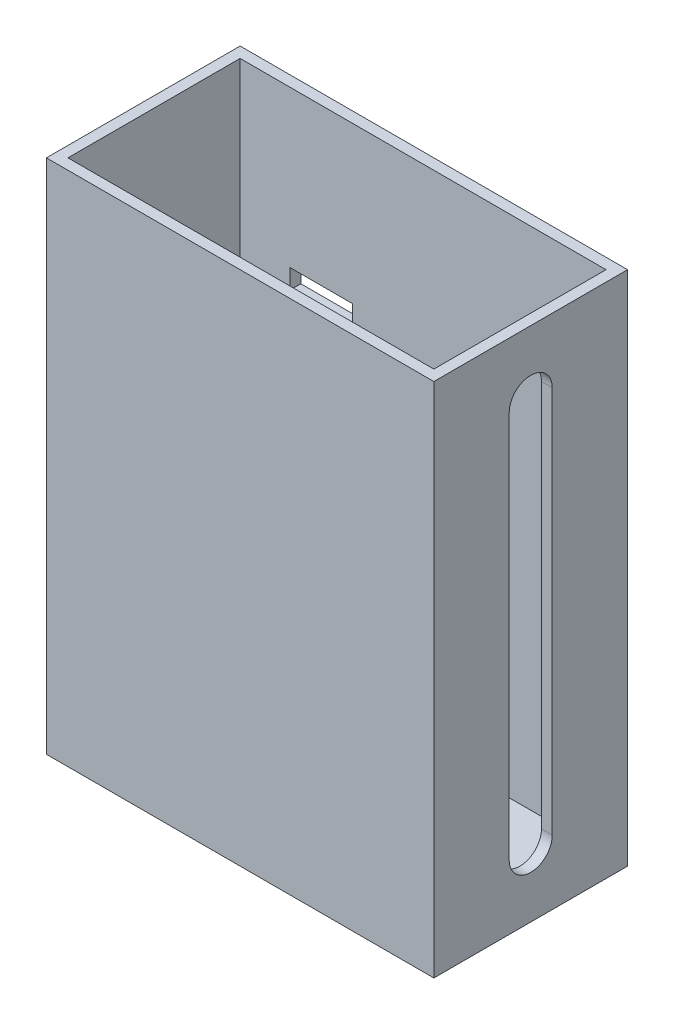
from build123d import *

# Parameters (mm, degrees)
SKETCH1_W           = 457.2
SKETCH1_H           = 228.6
BOSS_EXTRUDE1_DEPTH = 609.6
SHELL2_T            = -12.7
CUT_EXTRUDE2_REACH  = 772.525
CUT_EXTRUDE3_REACH  = 692.02
SKETCH4_W           = 31.75
SKETCH4_H           = 34.29
SKETCH4_W_2         = 36.83
SKETCH4_H_2         = 11.43
CUT_EXTRUDE17_DEPTH = 55.88


with BuildPart() as part:
    # Sketch1 → Boss-Extrude1 (new body)
    with BuildSketch(Plane(origin=(0, 0, 0), x_dir=(1, 0, 0), z_dir=(0, 1, 0))):
        Rectangle(SKETCH1_W, SKETCH1_H)
    extrude(amount=BOSS_EXTRUDE1_DEPTH)

    # Shell2
    shell2_openings = [part.faces().sort_by_distance(p)[0] for p in [
        (0, 609.6, 0),
    ]]
    offset(amount=SHELL2_T, openings=shell2_openings, kind=Kind.INTERSECTION)

    # Sketch3 → Cut-Extrude2 (cut, up to next)
    with BuildSketch(Plane(origin=(228.6, 0, 0), x_dir=(0, 0, -1), z_dir=(1, 0, 0)), mode=Mode.PRIVATE) as cut_extrude2_sk1:
        with BuildLine():
            Line((-25.4, 76.2), (-25.4, 533.4))
            ThreePointArc((-25.4, 533.4), (0, 558.8), (25.4, 533.4))
            Line((25.4, 533.4), (25.4, 76.2))
            ThreePointArc((25.4, 76.2), (0, 50.8), (-25.4, 76.2))
        make_face()
    cut_extrude2_tool1 = extrude(cut_extrude2_sk1.sketch, amount=-CUT_EXTRUDE2_REACH, mode=Mode.PRIVATE) & part.part
    add(cut_extrude2_tool1.solids().sort_by_distance((228.6, 304.8, 0))[0], mode=Mode.SUBTRACT)

    # Sketch4 → Cut-Extrude3 (cut, up to next)
    with BuildSketch(Plane(origin=(0, 0, -114.3), x_dir=(-1, 0, 0), z_dir=(0, 0, -1)), mode=Mode.PRIVATE) as cut_extrude3_sk1:
        with Locations((109.44862115, 351.970372474)):
            Rectangle(SKETCH4_W, SKETCH4_H)
    cut_extrude3_tool1 = extrude(cut_extrude3_sk1.sketch, amount=-CUT_EXTRUDE3_REACH, mode=Mode.PRIVATE) & part.part
    # Sketch4 → Cut-Extrude3 (cut, up to next)
    with BuildSketch(Plane(origin=(0, 0, -114.3), x_dir=(-1, 0, 0), z_dir=(0, 0, -1)), mode=Mode.PRIVATE) as cut_extrude3_sk2:
        with Locations((109.44862115, 317.680372474)):
            Rectangle(SKETCH4_W, SKETCH4_H)
    cut_extrude3_tool2 = extrude(cut_extrude3_sk2.sketch, amount=-CUT_EXTRUDE3_REACH, mode=Mode.PRIVATE) & part.part
    # Sketch4 → Cut-Extrude3 (cut, up to next)
    with BuildSketch(Plane(origin=(0, 0, -114.3), x_dir=(-1, 0, 0), z_dir=(0, 0, -1)), mode=Mode.PRIVATE) as cut_extrude3_sk3:
        with Locations((141.19862115, 317.680372474)):
            Rectangle(SKETCH4_W, SKETCH4_H)
    cut_extrude3_tool3 = extrude(cut_extrude3_sk3.sketch, amount=-CUT_EXTRUDE3_REACH, mode=Mode.PRIVATE) & part.part
    # Sketch4 → Cut-Extrude3 (cut, up to next)
    with BuildSketch(Plane(origin=(0, 0, -114.3), x_dir=(-1, 0, 0), z_dir=(0, 0, -1)), mode=Mode.PRIVATE) as cut_extrude3_sk4:
        with Locations((141.19862115, 351.970372474)):
            Rectangle(SKETCH4_W, SKETCH4_H)
    cut_extrude3_tool4 = extrude(cut_extrude3_sk4.sketch, amount=-CUT_EXTRUDE3_REACH, mode=Mode.PRIVATE) & part.part
    # Sketch4 → Cut-Extrude3 (cut, up to next)
    with BuildSketch(Plane(origin=(0, 0, -114.3), x_dir=(-1, 0, 0), z_dir=(0, 0, -1)), mode=Mode.PRIVATE) as cut_extrude3_sk5:
        with Locations((138.56658474, 419.56196337)):
            Rectangle(SKETCH4_W_2, SKETCH4_H_2)
    cut_extrude3_tool5 = extrude(cut_extrude3_sk5.sketch, amount=-CUT_EXTRUDE3_REACH, mode=Mode.PRIVATE) & part.part
    # Sketch4 → Cut-Extrude3 (cut, up to next)
    with BuildSketch(Plane(origin=(0, 0, -114.3), x_dir=(-1, 0, 0), z_dir=(0, 0, -1)), mode=Mode.PRIVATE) as cut_extrude3_sk6:
        with Locations((138.56658474, 408.13196337)):
            Rectangle(SKETCH4_W_2, SKETCH4_H_2)
    cut_extrude3_tool6 = extrude(cut_extrude3_sk6.sketch, amount=-CUT_EXTRUDE3_REACH, mode=Mode.PRIVATE) & part.part
    # Sketch4 → Cut-Extrude3 (cut, up to next)
    with BuildSketch(Plane(origin=(0, 0, -114.3), x_dir=(-1, 0, 0), z_dir=(0, 0, -1)), mode=Mode.PRIVATE) as cut_extrude3_sk7:
        with Locations((101.73658474, 419.56196337)):
            Rectangle(SKETCH4_W_2, SKETCH4_H_2)
    cut_extrude3_tool7 = extrude(cut_extrude3_sk7.sketch, amount=-CUT_EXTRUDE3_REACH, mode=Mode.PRIVATE) & part.part
    # Sketch4 → Cut-Extrude3 (cut, up to next)
    with BuildSketch(Plane(origin=(0, 0, -114.3), x_dir=(-1, 0, 0), z_dir=(0, 0, -1)), mode=Mode.PRIVATE) as cut_extrude3_sk8:
        with Locations((101.73658474, 408.13196337)):
            Rectangle(SKETCH4_W_2, SKETCH4_H_2)
    cut_extrude3_tool8 = extrude(cut_extrude3_sk8.sketch, amount=-CUT_EXTRUDE3_REACH, mode=Mode.PRIVATE) & part.part
    add(cut_extrude3_tool1.solids().sort_by_distance((-109.448621, 351.970372, -114.3))[0], mode=Mode.SUBTRACT)
    add(cut_extrude3_tool2.solids().sort_by_distance((-109.448621, 317.680372, -114.3))[0], mode=Mode.SUBTRACT)
    add(cut_extrude3_tool3.solids().sort_by_distance((-141.198621, 317.680372, -114.3))[0], mode=Mode.SUBTRACT)
    add(cut_extrude3_tool4.solids().sort_by_distance((-141.198621, 351.970372, -114.3))[0], mode=Mode.SUBTRACT)
    add(cut_extrude3_tool5.solids().sort_by_distance((-138.566585, 419.561963, -114.3))[0], mode=Mode.SUBTRACT)
    add(cut_extrude3_tool6.solids().sort_by_distance((-138.566585, 408.131963, -114.3))[0], mode=Mode.SUBTRACT)
    add(cut_extrude3_tool7.solids().sort_by_distance((-101.736585, 419.561963, -114.3))[0], mode=Mode.SUBTRACT)
    add(cut_extrude3_tool8.solids().sort_by_distance((-101.736585, 408.131963, -114.3))[0], mode=Mode.SUBTRACT)

    # Sketch11 → Cut-Extrude17 (cut)
    with BuildSketch(Plane.ZY.offset(228.6)):
        with BuildLine():
            Line((-65.38521106, 17.765922532), (-88.113220021, 17.765922532))
            ThreePointArc((-88.113220021, 17.765922532), (-94.463220021, 24.115922532), (-88.113220021, 30.465922532))
            Line((-88.113220021, 30.465922532), (-65.38521106, 30.465922532))
            ThreePointArc((-65.38521106, 30.465922532), (-59.03521106, 24.115922532), (-65.38521106, 17.765922532))
        make_face()
    extrude(amount=-CUT_EXTRUDE17_DEPTH, mode=Mode.SUBTRACT)


solid = part.part
